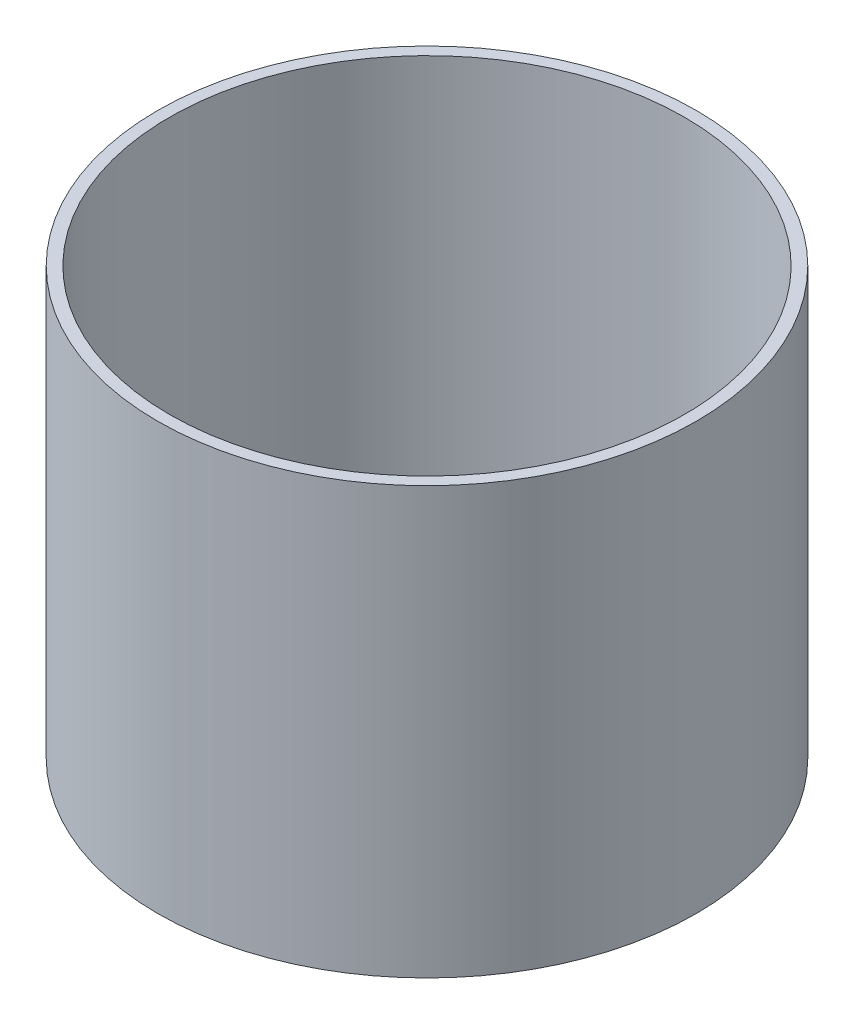
from build123d import *


with BuildPart() as part:
    # Sketch1 → Revolve1 (revolve)
    with BuildSketch(Plane.XY, mode=Mode.PRIVATE) as revolve1_sk:
        Polygon((0, -85.4875), (109.3, -85.4875), (109.3, 90.4875), (114.3, 90.4875), (114.3, -90.4875), (0, -90.4875), align=None)
    revolve(revolve1_sk.sketch.rotate(Axis((0, -167.349469112, 0), (0, 1, 0)), 90), axis=Axis((0, -167.349469112, 0), (0, 1, 0)))


solid = part.part
